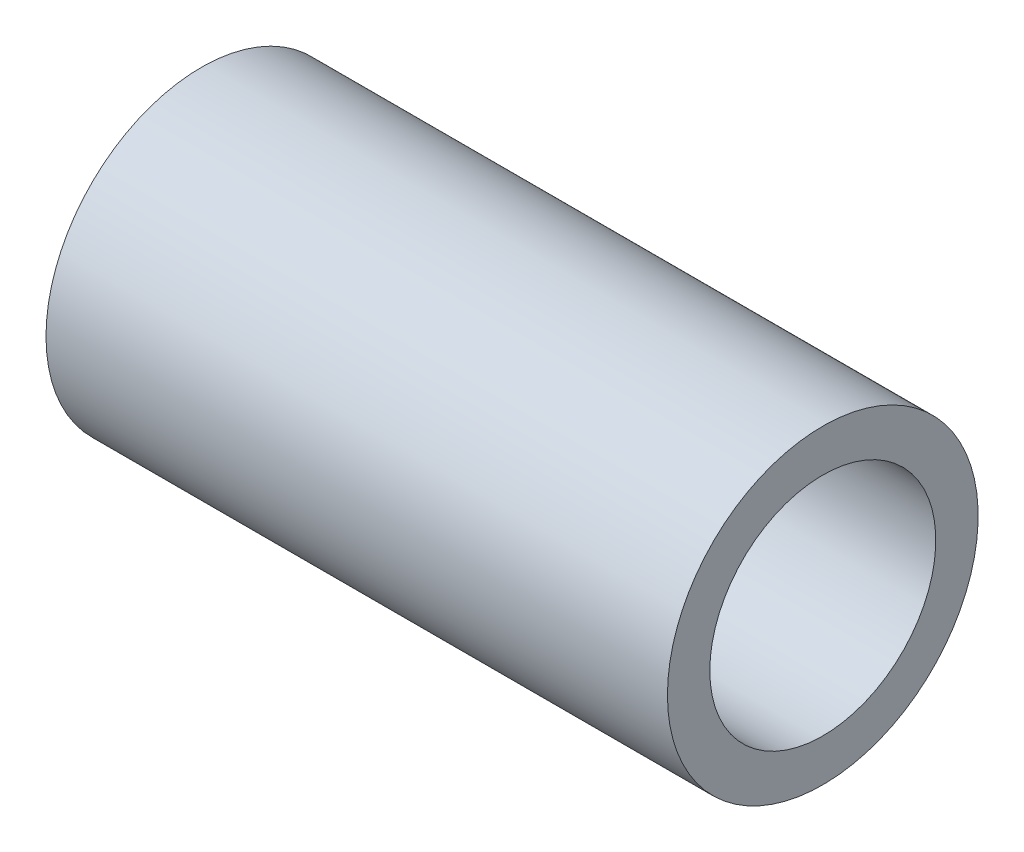
from build123d import *

# Parameters (mm, degrees)
ESBO_O1_W = 22
ESBO_O1_H = 1.5


with BuildPart() as part:
    # Esboço1 → Revolução1 (revolve)
    with BuildSketch(Plane.XY, mode=Mode.PRIVATE) as revolu_o1_sk:
        with Locations((11, 4.75)):
            Rectangle(ESBO_O1_W, ESBO_O1_H)
    revolve(revolu_o1_sk.sketch.rotate(Axis((0, 0, 0), (1, 0, 0)), 90), axis=Axis((0, 0, 0), (1, 0, 0)))


solid = part.part
